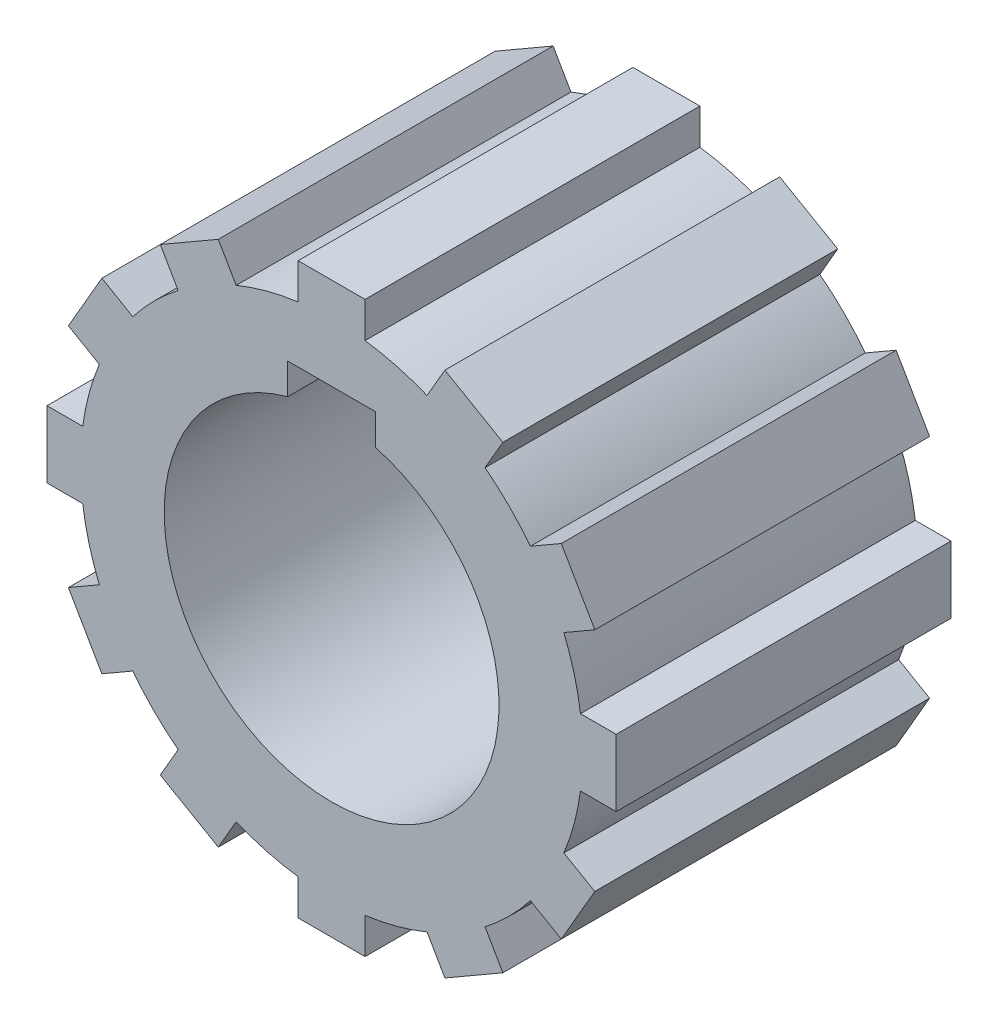
from build123d import *

# Parameters (mm, degrees)
EXTRUDE_1_DEPTH     = 20
CUT_EXTRUDE_2_DEPTH = 32.272991542


with BuildPart() as part:
    # 草图1 → 凸台-拉伸1 (new body)
    with BuildSketch(Plane.XY):
        with BuildLine():
            Line((6.767949192, 15.722431864), (5.700983566, 13.87439319))
            ThreePointArc((5.700983566, 13.87439319), (3.882285677, 14.488887394), (2, 14.866068747))
            Line((2, 14.866068747), (2, 17))
            Line((2, 17), (-2, 17))
            Line((-2, 17), (-2, 14.866068747))
            ThreePointArc((-2, 14.866068747), (-3.882285677, 14.488887394), (-5.700983566, 13.87439319))
            Line((-5.700983566, 13.87439319), (-6.767949192, 15.722431864))
            Line((-6.767949192, 15.722431864), (-10.232050808, 13.722431864))
            Line((-10.232050808, 13.722431864), (-9.165085181, 11.87439319))
            ThreePointArc((-9.165085181, 11.87439319), (-10.606601718, 10.606601718), (-11.87439319, 9.165085181))
            Line((-11.87439319, 9.165085181), (-13.722431864, 10.232050808))
            Line((-13.722431864, 10.232050808), (-15.722431864, 6.767949192))
            Line((-15.722431864, 6.767949192), (-13.87439319, 5.700983566))
            ThreePointArc((-13.87439319, 5.700983566), (-14.488887394, 3.882285677), (-14.866068747, 2))
            Line((-14.866068747, 2), (-17, 2))
            Line((-17, 2), (-17, -2))
            Line((-17, -2), (-14.866068747, -2))
            ThreePointArc((-14.866068747, -2), (-14.488887394, -3.882285677), (-13.87439319, -5.700983566))
            Line((-13.87439319, -5.700983566), (-15.722431864, -6.767949192))
            Line((-15.722431864, -6.767949192), (-13.722431864, -10.232050808))
            Line((-13.722431864, -10.232050808), (-11.87439319, -9.165085181))
            ThreePointArc((-11.87439319, -9.165085181), (-10.606601718, -10.606601718), (-9.165085181, -11.87439319))
            Line((-9.165085181, -11.87439319), (-10.232050808, -13.722431864))
            Line((-10.232050808, -13.722431864), (-6.767949192, -15.722431864))
            Line((-6.767949192, -15.722431864), (-5.700983566, -13.87439319))
            ThreePointArc((-5.700983566, -13.87439319), (-3.882285677, -14.488887394), (-2, -14.866068747))
            Line((-2, -14.866068747), (-2, -17))
            Line((-2, -17), (2, -17))
            Line((2, -17), (2, -14.866068747))
            ThreePointArc((2, -14.866068747), (3.882285677, -14.488887394), (5.700983566, -13.87439319))
            Line((5.700983566, -13.87439319), (6.767949192, -15.722431864))
            Line((6.767949192, -15.722431864), (10.232050808, -13.722431864))
            Line((10.232050808, -13.722431864), (9.165085181, -11.87439319))
            ThreePointArc((9.165085181, -11.87439319), (10.606601718, -10.606601718), (11.87439319, -9.165085181))
            Line((11.87439319, -9.165085181), (13.722431864, -10.232050808))
            Line((13.722431864, -10.232050808), (15.722431864, -6.767949192))
            Line((15.722431864, -6.767949192), (13.87439319, -5.700983566))
            ThreePointArc((13.87439319, -5.700983566), (14.488887394, -3.882285677), (14.866068747, -2))
            Line((14.866068747, -2), (17, -2))
            Line((17, -2), (17, 2))
            Line((17, 2), (14.866068747, 2))
            ThreePointArc((14.866068747, 2), (14.488887394, 3.882285677), (13.87439319, 5.700983566))
            Line((13.87439319, 5.700983566), (15.722431864, 6.767949192))
            Line((15.722431864, 6.767949192), (13.722431864, 10.232050808))
            Line((13.722431864, 10.232050808), (11.87439319, 9.165085181))
            ThreePointArc((11.87439319, 9.165085181), (10.606601718, 10.606601718), (9.165085181, 11.87439319))
            Line((9.165085181, 11.87439319), (10.232050808, 13.722431864))
            Line((10.232050808, 13.722431864), (6.767949192, 15.722431864))
        make_face()
    extrude(amount=EXTRUDE_1_DEPTH)

    # 草图2 → 切除-拉伸2 (cut, through all)
    with BuildSketch(Plane.XY.offset(20)):
        with BuildLine():
            Line((2.624865364, 11.5), (-2.624865364, 11.5))
            Line((-2.624865364, 11.5), (-2.624865364, 9.64935655))
            ThreePointArc((-2.624865364, 9.64935655), (0, 10), (2.624865364, 9.64935655))
            Line((2.624865364, 9.64935655), (2.624865364, 11.5))
        make_face()
        with BuildLine():
            ThreePointArc((2.624865364, 9.64935655), (0, 10), (-2.624865364, 9.64935655))
            Line((-2.624865364, 9.64935655), (-2.624865364, 8.5))
            Line((-2.624865364, 8.5), (2.624865364, 8.5))
            Line((2.624865364, 8.5), (2.624865364, 9.64935655))
        make_face()
        with BuildLine():
            Line((-2.624865364, 8.5), (-2.624865364, 9.64935655))
            ThreePointArc((-2.624865364, 9.64935655), (-6.072534329, -7.945081927), (10, 0))
            ThreePointArc((10, 0), (7.945081927, 6.072534329), (2.624865364, 9.64935655))
            Line((2.624865364, 9.64935655), (2.624865364, 8.5))
            Line((2.624865364, 8.5), (-2.624865364, 8.5))
        make_face()
    extrude(amount=-CUT_EXTRUDE_2_DEPTH, mode=Mode.SUBTRACT)


solid = part.part
